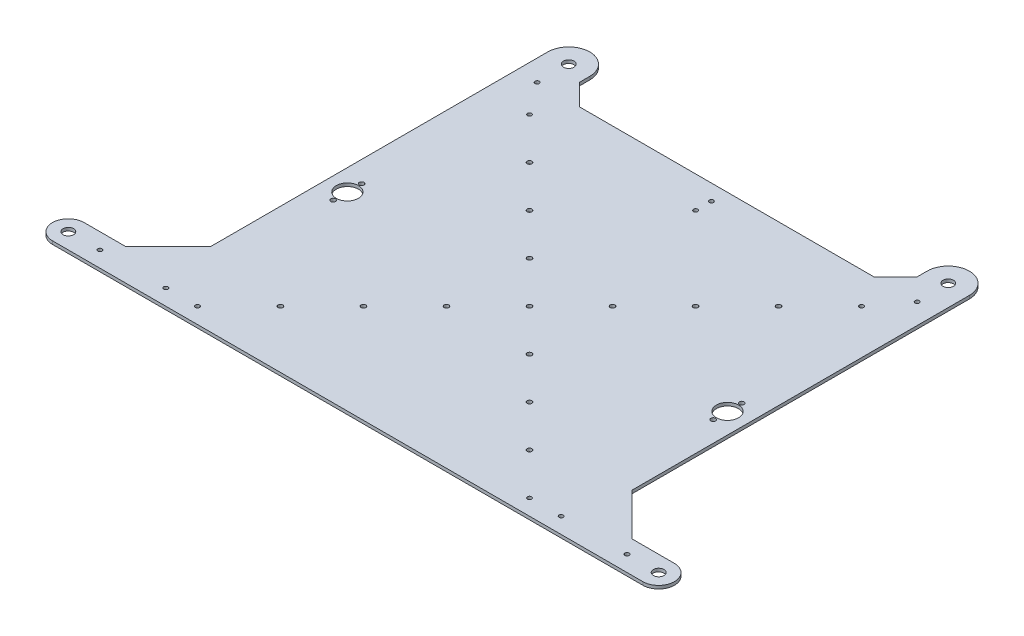
from build123d import *

# Parameters (mm, degrees)
SKETCH1_R           = 2
SKETCH1_R_2         = 5
SKETCH1_R_3         = 10.5
SKETCH1_R_4         = 2.25
BOSS_EXTRUDE1_DEPTH = 3
SKETCH2_R           = 5
BOSS_EXTRUDE2_DEPTH = 3
CHAMFER2_SIZE       = 20
CHAMFER3_SIZE       = 40
SKETCH3_R           = 2
CUT_EXTRUDE1_DEPTH  = 10
SKETCH5_R           = 2.25
CUT_EXTRUDE2_DEPTH  = 10
SKETCH6_R           = 2
CUT_EXTRUDE3_DEPTH  = 171
SKETCH7_R           = 2
CUT_EXTRUDE4_DEPTH  = 22


with BuildPart() as part:
    # Sketch1 → Boss-Extrude1 (new body)
    with BuildSketch(Plane(origin=(0, 0, 0), x_dir=(1, 0, 0), z_dir=(0, 1, 0))):
        with BuildLine():
            Line((-200.2851606, -142.500000035), (-280, -142.500000035))
            ThreePointArc((-280, -142.500000035), (-294.999999965, -157.5), (-280, -172.499999965))
            Line((-280, -172.499999965), (280, -172.499999965))
            ThreePointArc((280, -172.499999965), (294.999999965, -157.5), (280, -142.500000035))
            Line((280, -142.500000035), (199.7148394, -142.500000035))
            Line((199.7148394, -142.500000035), (199.7148394, 187.499999965))
            Line((199.7148394, 187.499999965), (-160.2851606, 187.499999965))
            Line((-160.2851606, 187.499999965), (-160.2851606, 217.499999965))
            ThreePointArc((-160.2851606, 217.499999965), (-180.2851606, 237.499999965), (-200.2851606, 217.499999965))
            Line((-200.2851606, 217.499999965), (-200.2851606, 187.499999965))
            Line((-200.2851606, 187.499999965), (-200.2851606, -142.500000035))
        make_face()
        with Locations(Location((-157.5, 157.5, 0), (0, 0, 270))):
            Circle(SKETCH1_R, mode=Mode.SUBTRACT)
        with Locations(Location((157.5, 157.5, 0), (0, 0, 270))):
            Circle(SKETCH1_R, mode=Mode.SUBTRACT)
        with Locations(Location((157.5, -157.5, 0), (0, 0, 270))):
            Circle(SKETCH1_R, mode=Mode.SUBTRACT)
        with Locations(Location((-157.5, -157.5, 0), (0, 0, 270))):
            Circle(SKETCH1_R, mode=Mode.SUBTRACT)
        with Locations(Location((-280, -157.5, 0), (0, 0, 270))):
            Circle(SKETCH1_R_2, mode=Mode.SUBTRACT)
        with Locations(Location((280, -157.5, 0), (0, 0, 270))):
            Circle(SKETCH1_R_2, mode=Mode.SUBTRACT)
        with Locations(Location((-250, -157.5, 0), (0, 0, 270))):
            Circle(SKETCH1_R, mode=Mode.SUBTRACT)
        with Locations(Location((250, -157.5, 0), (0, 0, 270))):
            Circle(SKETCH1_R, mode=Mode.SUBTRACT)
        with Locations(Location((-180.2851606, 7.499999983, 0), (0, 0, 270))):
            Circle(SKETCH1_R_3, mode=Mode.SUBTRACT)
        with Locations(Location((-180.2851606, 20.999999983, 0), (0, 0, 270))):
            Circle(SKETCH1_R_4, mode=Mode.SUBTRACT)
        with Locations(Location((-180.2851606, -6.000000017, 0), (0, 0, 270))):
            Circle(SKETCH1_R_4, mode=Mode.SUBTRACT)
        with Locations(Location((180.2851606, -6.000000017, 0), (0, 0, 90))):
            Circle(SKETCH1_R_4, mode=Mode.SUBTRACT)
        with Locations(Location((180.2851606, 20.999999983, 0), (0, 0, 90))):
            Circle(SKETCH1_R_4, mode=Mode.SUBTRACT)
        with Locations(Location((180.2851606, 7.499999983, 0), (0, 0, 90))):
            Circle(SKETCH1_R_3, mode=Mode.SUBTRACT)
        with Locations(Location((-180.2851606, 217.499999965, 0), (0, 0, 270))):
            Circle(SKETCH1_R_2, mode=Mode.SUBTRACT)
    extrude(amount=BOSS_EXTRUDE1_DEPTH)

    # Sketch2 → Boss-Extrude2 (add)
    with BuildSketch(Plane(origin=(0, 3, 0), x_dir=(1, 0, 0), z_dir=(0, 1, 0))):
        with BuildLine():
            Line((199.7148394, 187.499999965), (199.7148394, 217.499999965))
            ThreePointArc((199.7148394, 217.499999965), (179.7148394, 237.499999965), (159.7148394, 217.499999965))
            Line((159.7148394, 217.499999965), (159.7148394, 187.499999965))
            Line((159.7148394, 187.499999965), (199.7148394, 187.499999965))
        make_face()
        with Locations(Location((179.7148394, 217.499999965, 0), (0, 0, 270))):
            Circle(SKETCH2_R, mode=Mode.SUBTRACT)
    extrude(amount=-BOSS_EXTRUDE2_DEPTH)

    # Chamfer2
    chamfer2_edges = [part.edges().sort_by_distance(p)[0] for p in [
        (-160.2851606, 1.5, -187.499999965),
        (159.7148394, 1.5, -187.499999965),
    ]]
    chamfer(chamfer2_edges, length=CHAMFER2_SIZE)

    # Chamfer3
    chamfer3_edges = [part.edges().sort_by_distance(p)[0] for p in [
        (-200.2851606, 1.5, 142.500000035),
        (199.7148394, 1.5, 142.500000035),
    ]]
    chamfer(chamfer3_edges, length=CHAMFER3_SIZE)

    # Sketch3 → Cut-Extrude1 (cut)
    with BuildSketch(Plane(origin=(0, 3, 0), x_dir=(1, 0, 0), z_dir=(0, 1, 0))):
        with Locations(Location((-180.2851606, 187.499999965, 0), (0, 0, 270))):
            Circle(SKETCH3_R)
    cut_extrude1 = extrude(amount=-CUT_EXTRUDE1_DEPTH, mode=Mode.SUBTRACT)

    # Mirror1: Cut-Extrude1 across plane
    add(cut_extrude1.mirror(Plane(origin=(0, 0, 0), x_dir=(0, 0, 1), z_dir=(1, 0, 0))), mode=Mode.SUBTRACT)

    # Sketch5 → Cut-Extrude2 (cut)
    with BuildSketch(Plane(origin=(0, 3, 0), x_dir=(1, 0, 0), z_dir=(0, 1, 0))):
        with Locations(Location((118.125, -118.125, 0), (0, 0, 270))):
            Circle(SKETCH5_R)
        with Locations(Location((78.75, -78.75, 0), (0, 0, 270))):
            Circle(SKETCH5_R)
        with Locations(Location((39.375, -39.375, 0), (0, 0, 270))):
            Circle(SKETCH5_R)
        with Locations(Location((-39.375, -39.375, 0), (0, 0, 270))):
            Circle(SKETCH5_R)
        with Locations(Location((-78.75, -78.75, 0), (0, 0, 270))):
            Circle(SKETCH5_R)
        with Locations(Location((-118.125, -118.125, 0), (0, 0, 270))):
            Circle(SKETCH5_R)
        with Locations(Location((-39.375, 39.375, 0), (0, 0, 270))):
            Circle(SKETCH5_R)
        with Locations(Location((-78.75, 78.75, 0), (0, 0, 270))):
            Circle(SKETCH5_R)
        with Locations(Location((-118.125, 118.125, 0), (0, 0, 270))):
            Circle(SKETCH5_R)
        with Locations(Location((39.375, 39.375, 0), (0, 0, 270))):
            Circle(SKETCH5_R)
        with Locations(Location((78.75, 78.75, 0), (0, 0, 270))):
            Circle(SKETCH5_R)
        with Locations(Location((118.125, 118.125, 0), (0, 0, 270))):
            Circle(SKETCH5_R)
        with Locations(Location((0, 0, 0), (0, 0, 270))):
            Circle(SKETCH5_R)
    extrude(amount=-CUT_EXTRUDE2_DEPTH, mode=Mode.SUBTRACT)

    # Sketch6 → Cut-Extrude3 (cut)
    with BuildSketch(Plane(origin=(0, 3, 0), x_dir=(1, 0, 0), z_dir=(0, 1, 0))):
        with Locations(Location((0, 157.5, 0), (0, 0, 270))):
            Circle(SKETCH6_R)
        with Locations(Location((-187.5, -157.5, 0), (0, 0, 270))):
            Circle(SKETCH6_R)
        with Locations(Location((187.5, -157.5, 0), (0, 0, 270))):
            Circle(SKETCH6_R)
    extrude(amount=-CUT_EXTRUDE3_DEPTH, mode=Mode.SUBTRACT)

    # Sketch7 → Cut-Extrude4 (cut)
    with BuildSketch(Plane(origin=(0, 3, 0), x_dir=(1, 0, 0), z_dir=(0, 1, 0))):
        with Locations(Location((0, 172.5, 0), (0, 0, 270))):
            Circle(SKETCH7_R)
    extrude(amount=-CUT_EXTRUDE4_DEPTH, mode=Mode.SUBTRACT)


solid = part.part
